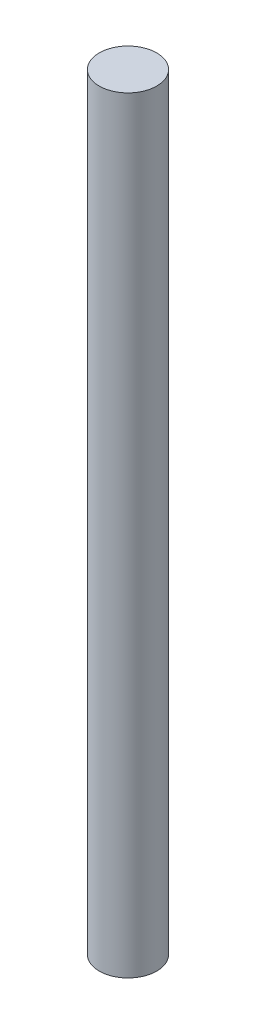
from build123d import *

# Parameters (mm, degrees)
SKETCH1_R           = 7.5
BOSS_EXTRUDE1_DEPTH = 200


with BuildPart() as part:
    # Sketch1 → Boss-Extrude1 (new body)
    with BuildSketch(Plane(origin=(0, 0, 0), x_dir=(1, 0, 0), z_dir=(0, 1, 0))):
        with Locations(Location((0, 0, 0), (0, 0, 270))):
            Circle(SKETCH1_R)
    extrude(amount=BOSS_EXTRUDE1_DEPTH)


solid = part.part
